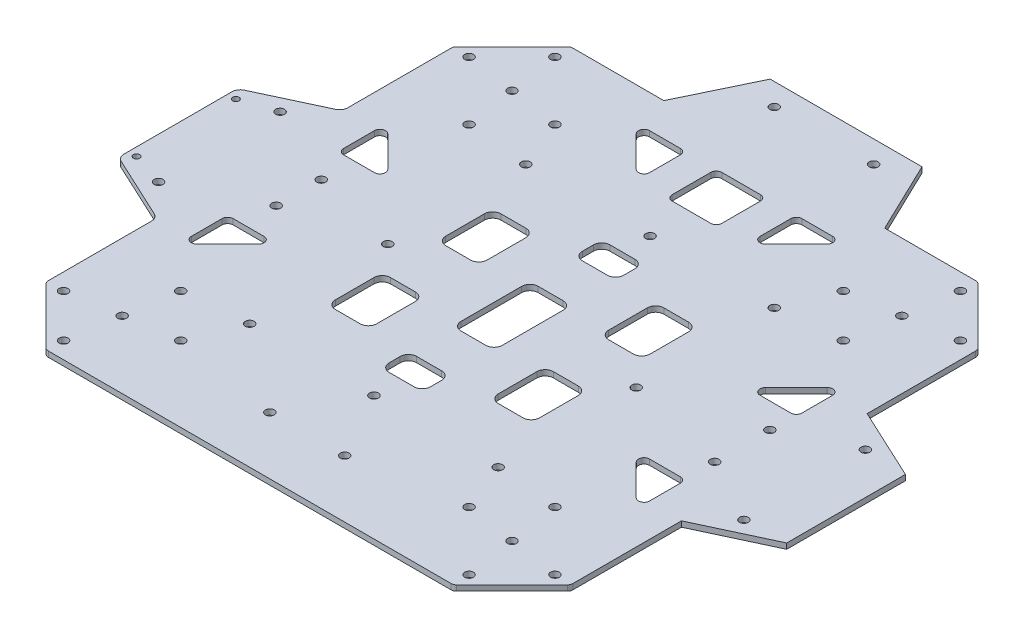
from build123d import *

# Parameters (mm, degrees)
SKETCH_1_R             = 1.6
EXTRUDE_1_DEPTH        = 2
FILLET_1_R             = 2
SKETCH_2_W             = 18
SKETCH_2_H             = 18
CUT_EXTRUDE_1_DEPTH    = 135.365174059
FILLET_2_R             = 2
EXTRUDE_2_DEPTH        = 2
FILLET_3_R             = 3
SKETCH_5_R             = 1.6
SKETCH_5_W             = 15
SKETCH_5_H             = 20
SKETCH_5_H_2           = 28
SKETCH_5_H_3           = 10
CUT_EXTRUDE_3_DEPTH    = 10
FILLET_4_R             = 3
SKETCH_6_R             = 1.15
CUT_EXTRUDE_8567_DEPTH = 10
SKETCH_7_R             = 1.6
EXTRUDE_3_DEPTH        = 2
SKETCH_8_R             = 1.6
CUT_EXTRUDE_4_DEPTH    = 10


with BuildPart() as part:
    # 草图1 → 凸台-拉伸1 (new body)
    with BuildSketch(Plane(origin=(0, 0, 0), x_dir=(1, 0, 0), z_dir=(0, 1, 0))):
        Polygon((95, -73.786796564), (95, 73.786796564), (73.786796564, 95), (-73.786796564, 95), (-95, 73.786796564), (-95, -73.786796564), (-73.786796564, -95), (73.786796564, -95), align=None)
        with Locations(Location((-88.98959236, -73.433243174, 0), (0, 0, 270))):
            Circle(SKETCH_1_R, mode=Mode.SUBTRACT)
        with Locations(Location((-73.433243174, -88.98959236, 0), (0, 0, 270))):
            Circle(SKETCH_1_R, mode=Mode.SUBTRACT)
        with Locations(Location((-73.433243174, 88.98959236, 0), (0, 0, 270))):
            Circle(SKETCH_1_R, mode=Mode.SUBTRACT)
        with Locations(Location((-88.98959236, 73.433243174, 0), (0, 0, 270))):
            Circle(SKETCH_1_R, mode=Mode.SUBTRACT)
        with Locations(Location((73.433243174, 88.98959236, 0), (0, 0, 270))):
            Circle(SKETCH_1_R, mode=Mode.SUBTRACT)
        with Locations(Location((88.98959236, 73.433243174, 0), (0, 0, 270))):
            Circle(SKETCH_1_R, mode=Mode.SUBTRACT)
        with Locations(Location((88.98959236, -73.433243174, 0), (0, 0, 270))):
            Circle(SKETCH_1_R, mode=Mode.SUBTRACT)
        with Locations(Location((73.433243174, -88.98959236, 0), (0, 0, 270))):
            Circle(SKETCH_1_R, mode=Mode.SUBTRACT)
        with Locations(Location((-67.776388924, -52.220039738, 0), (0, 0, 270))):
            Circle(SKETCH_1_R, mode=Mode.SUBTRACT)
        with Locations(Location((-52.220039738, -67.776388924, 0), (0, 0, 270))):
            Circle(SKETCH_1_R, mode=Mode.SUBTRACT)
        with Locations(Location((67.776388924, -52.220039738, 0), (0, 0, 270))):
            Circle(SKETCH_1_R, mode=Mode.SUBTRACT)
        with Locations(Location((52.220039738, -67.776388924, 0), (0, 0, 270))):
            Circle(SKETCH_1_R, mode=Mode.SUBTRACT)
        with Locations(Location((67.776388924, 52.220039738, 0), (0, 0, 270))):
            Circle(SKETCH_1_R, mode=Mode.SUBTRACT)
        with Locations(Location((52.220039738, 67.776388924, 0), (0, 0, 270))):
            Circle(SKETCH_1_R, mode=Mode.SUBTRACT)
        with Locations(Location((-67.776388924, 52.220039738, 0), (0, 0, 270))):
            Circle(SKETCH_1_R, mode=Mode.SUBTRACT)
        with Locations(Location((-52.220039738, 67.776388924, 0), (0, 0, 270))):
            Circle(SKETCH_1_R, mode=Mode.SUBTRACT)
        with Locations(Location((-70.604816049, -70.604816049, 0), (0, 0, 270))):
            Circle(SKETCH_1_R, mode=Mode.SUBTRACT)
        with Locations(Location((-70.604816049, 70.604816049, 0), (0, 0, 270))):
            Circle(SKETCH_1_R, mode=Mode.SUBTRACT)
        with Locations(Location((70.604816049, -70.604816049, 0), (0, 0, 270))):
            Circle(SKETCH_1_R, mode=Mode.SUBTRACT)
        with Locations(Location((70.604816049, 70.604816049, 0), (0, 0, 270))):
            Circle(SKETCH_1_R, mode=Mode.SUBTRACT)
    extrude(amount=EXTRUDE_1_DEPTH)

    # 圆角1
    fillet_1_edges = [part.edges().sort_by_distance(p)[0] for p in [
        (-73.786796564, 1, 95),
        (-95, 1, 73.786796564),
        (-95, 1, -73.786796564),
        (-73.786796564, 1, -95),
        (73.786796564, 1, -95),
        (95, 1, -73.786796564),
        (95, 1, 73.786796564),
        (73.786796564, 1, 95),
    ]]
    fillet(fillet_1_edges, radius=FILLET_1_R)

    # 草图2 → 切除-拉伸1 (cut, through all)
    with BuildSketch(Plane(origin=(0, 2, 0), x_dir=(1, 0, 0), z_dir=(0, 1, 0))):
        Polygon((-65, 20), (-83, 38), (-83, 20), align=None)
        Polygon((-83, -38), (-83, -20), (-65, -20), align=None)
        Polygon((20, 65), (38, 83), (20, 83), align=None)
        Polygon((-38, 83), (-20, 83), (-20, 65), align=None)
        with Locations((0, 74)):
            Rectangle(SKETCH_2_W, SKETCH_2_H)
        Polygon((65, -20), (83, -38), (83, -20), align=None)
        Polygon((83, 38), (83, 20), (65, 20), align=None)
    extrude(amount=-CUT_EXTRUDE_1_DEPTH, mode=Mode.SUBTRACT)

    # 圆角2
    fillet_2_edges = [part.edges().sort_by_distance(p)[0] for p in [
        (65, 1, -20),
        (83, 1, -38),
        (83, 1, -20),
        (65, 1, 20),
        (83, 1, 20),
        (83, 1, 38),
        (-65, 1, 20),
        (-83, 1, 38),
        (-83, 1, 20),
        (20, 1, -65),
        (20, 1, -83),
        (38, 1, -83),
        (-20, 1, -65),
        (-38, 1, -83),
        (-20, 1, -83),
        (9, 1, -83),
        (9, 1, -65),
        (-9, 1, -65),
        (-9, 1, -83),
        (-65, 1, -20),
        (-83, 1, -20),
        (-83, 1, -38),
    ]]
    fillet(fillet_2_edges, radius=FILLET_2_R)

    # 草图4 → 凸台-拉伸2 (add)
    with BuildSketch(Plane(origin=(0, 2, 0), x_dir=(1, 0, 0), z_dir=(0, 1, 0))):
        Polygon((-121, -21.5), (-95, -33.623999112), (-95, -21.5), (-95, 21.5), (-95, 33.623999112), (-121, 21.5), align=None)
        Polygon((95, 33.623999112), (95, 21.5), (95, -21.5), (95, -33.623999112), (121, -21.5), (121, 21.5), align=None)
    extrude(amount=-EXTRUDE_2_DEPTH)

    # 圆角3
    fillet_3_edges = [part.edges().sort_by_distance(p)[0] for p in [
        (-95, 1, 33.623999112),
        (-121, 1, 21.5),
        (-121, 1, -21.5),
        (-95, 1, -33.623999112),
    ]]
    fillet(fillet_3_edges, radius=FILLET_3_R)

    # 草图5 → 切除-拉伸3 (cut)
    with BuildSketch(Plane.XZ):
        with Locations(Location((-106, 22, 0), (0, 0, 90))):
            Circle(SKETCH_5_R)
        with Locations(Location((-106, -22, 0), (0, 0, 270))):
            Circle(SKETCH_5_R)
        with Locations(Location((106, -22, 0), (0, 0, 90))):
            Circle(SKETCH_5_R)
        with Locations(Location((106, 22, 0), (0, 0, 270))):
            Circle(SKETCH_5_R)
        with Locations(Location((82.5, -10.895903559, 0), (0, 0, 270))):
            Circle(SKETCH_5_R)
        with Locations(Location((82.5, 9.104096441, 0), (0, 0, 270))):
            Circle(SKETCH_5_R)
        with Locations(Location((-77.25, 8.16, 0), (0, 0, 270))):
            Circle(SKETCH_5_R)
        with Locations(Location((-77.25, -8.16, 0), (0, 0, 90))):
            Circle(SKETCH_5_R)
        with Locations(Location((13.55, 74.15, 0), (0, 0, 270))):
            Circle(SKETCH_5_R)
        with Locations(Location((-13.55, 74.15, 0), (0, 0, 270))):
            Circle(SKETCH_5_R)
        with Locations((-29.5, -20)):
            Rectangle(SKETCH_5_W, SKETCH_5_H)
        Rectangle(SKETCH_5_W, SKETCH_5_H_2)
        with Locations((-29.5, 20)):
            Rectangle(SKETCH_5_W, SKETCH_5_H)
        with Locations((29.5, 20)):
            Rectangle(SKETCH_5_W, SKETCH_5_H)
        with Locations((29.5, -20)):
            Rectangle(SKETCH_5_W, SKETCH_5_H)
        with Locations((0, -35)):
            Rectangle(SKETCH_5_W, SKETCH_5_H_3)
        with Locations((0, 35)):
            Rectangle(SKETCH_5_W, SKETCH_5_H_3)
    extrude(amount=-CUT_EXTRUDE_3_DEPTH, mode=Mode.SUBTRACT)

    # 圆角4
    fillet_4_edges = [part.edges().sort_by_distance(p)[0] for p in [
        (-7.5, 1, -40),
        (-7.5, 1, -30),
        (7.5, 1, -30),
        (7.5, 1, -40),
        (37, 1, -30),
        (22, 1, -30),
        (22, 1, -10),
        (37, 1, -10),
        (-37, 1, -30),
        (-37, 1, -10),
        (-22, 1, -10),
        (-22, 1, -30),
        (37, 1, 30),
        (37, 1, 10),
        (22, 1, 10),
        (22, 1, 30),
        (7.5, 1, 40),
        (7.5, 1, 30),
        (-7.5, 1, 30),
        (-7.5, 1, 40),
        (7.5, 1, 14),
        (7.5, 1, -14),
        (-7.5, 1, -14),
        (-7.5, 1, 14),
        (-37, 1, 10),
        (-37, 1, 30),
        (-22, 1, 30),
        (-22, 1, 10),
    ]]
    fillet(fillet_4_edges, radius=FILLET_4_R)

    # 草图6 → Cut-Extrude 8567 (cut)
    with BuildSketch(Plane.XZ):
        with Locations(Location((-118, 18, 0), (0, 0, 270))):
            Circle(SKETCH_6_R)
        with Locations(Location((-118, -18, 0), (0, 0, 270))):
            Circle(SKETCH_6_R)
    extrude(amount=-CUT_EXTRUDE_8567_DEPTH, mode=Mode.SUBTRACT)

    # 草图7 → 凸台-拉伸3 (add)
    with BuildSketch(Plane(origin=(0, 2, 0), x_dir=(1, 0, 0), z_dir=(0, 1, 0))):
        Polygon((-40, 95), (-27.5, 121), (27.5, 121), (40, 95), align=None)
        with Locations(Location((18, 113, 0), (0, 0, 270))):
            Circle(SKETCH_7_R, mode=Mode.SUBTRACT)
        with Locations(Location((-18, 113, 0), (0, 0, 270))):
            Circle(SKETCH_7_R, mode=Mode.SUBTRACT)
    extrude(amount=-EXTRUDE_3_DEPTH)

    # 草图8 → 切除-拉伸4 (cut)
    with BuildSketch(Plane(origin=(0, 2, 0), x_dir=(1, 0, 0), z_dir=(0, 1, 0))):
        with Locations(Location((-45, 50, 0), (0, 0, 270))):
            Circle(SKETCH_8_R)
        with Locations(Location((-45, -50, 0), (0, 0, 270))):
            Circle(SKETCH_8_R)
        with Locations(Location((45, -50, 0), (0, 0, 270))):
            Circle(SKETCH_8_R)
        with Locations(Location((45, 50, 0), (0, 0, 270))):
            Circle(SKETCH_8_R)
        with Locations(Location((0, -50, 0), (0, 0, 270))):
            Circle(SKETCH_8_R)
        with Locations(Location((0, 50, 0), (0, 0, 270))):
            Circle(SKETCH_8_R)
        with Locations(Location((45, 0, 0), (0, 0, 270))):
            Circle(SKETCH_8_R)
        with Locations(Location((-45, 0, 0), (0, 0, 270))):
            Circle(SKETCH_8_R)
    extrude(amount=-CUT_EXTRUDE_4_DEPTH, mode=Mode.SUBTRACT)


solid = part.part
